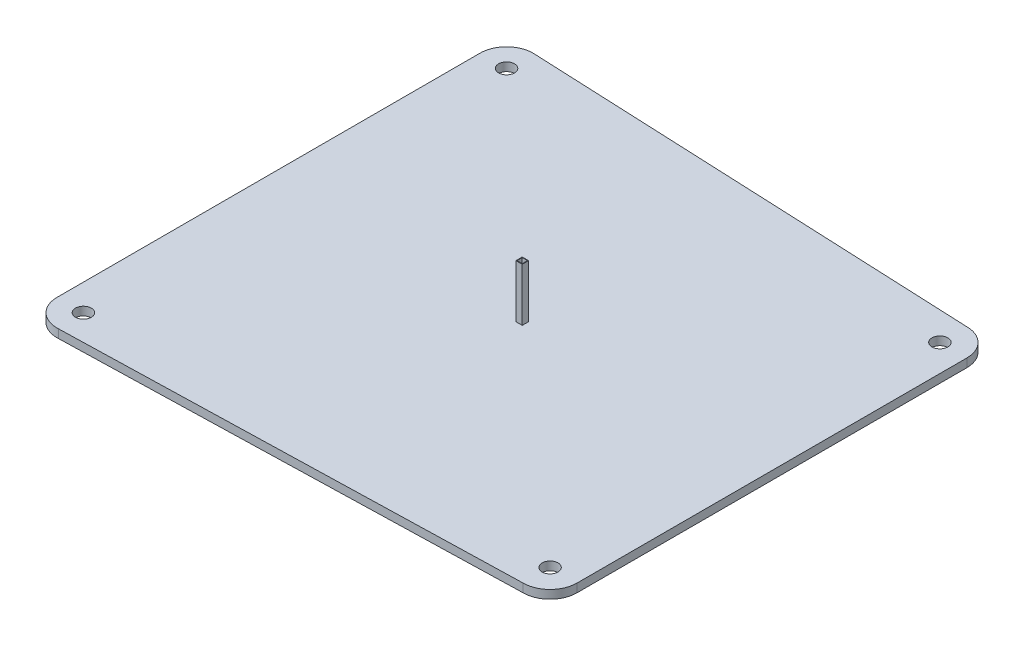
from build123d import *

# Parameters (mm, degrees)
SKETCH1_W              = 95.89
SKETCH1_H              = 90.17
SUBSTRATE_DEPTH        = 1.6
SKETCH2_R              = 1.5
CUT_EXTRUDE2_DEPTH     = 10
SKETCH3_W              = 1.2
SKETCH3_H              = 1.2
SKETCH3_W_2            = 1
SKETCH3_H_2            = 1
CENTRE_ALIGNMENT_DEPTH = 10
SKETCH4_OUTSIDE_W      = 124.318
SKETCH4_OUTSIDE_H      = 118.598
CUT_EXTRUDE3_DEPTH     = 10


with BuildPart() as part:
    # Sketch1 → Substrate (new body)
    with BuildSketch(Plane(origin=(0, 0, 0), x_dir=(1, 0, 0), z_dir=(0, 1, 0))):
        Rectangle(SKETCH1_W, SKETCH1_H)
    extrude(amount=SUBSTRATE_DEPTH)

    # Sketch2 → Cut-Extrude2 (cut)
    with BuildSketch(Plane(origin=(0, 1.6, 0), x_dir=(1, 0, 0), z_dir=(0, 1, 0))):
        with Locations(Location((42.845, 36.085, 0), (0, 0, 270))):
            Circle(SKETCH2_R)
        with Locations(Location((42.845, -37.585, 0), (0, 0, 270))):
            Circle(SKETCH2_R)
        with Locations(Location((-42.945, -39.985, 0), (0, 0, 270))):
            Circle(SKETCH2_R)
        with Locations(Location((-42.945, 39.985, 0), (0, 0, 270))):
            Circle(SKETCH2_R)
    extrude(amount=-CUT_EXTRUDE2_DEPTH, mode=Mode.SUBTRACT)

    # Sketch3 → Centre Alignment (add)
    with BuildSketch(Plane(origin=(0, 1.6, 0), x_dir=(1, 0, 0), z_dir=(0, 1, 0))):
        Rectangle(SKETCH3_W, SKETCH3_H)
        Rectangle(SKETCH3_W_2, SKETCH3_H_2, mode=Mode.SUBTRACT)
    extrude(amount=CENTRE_ALIGNMENT_DEPTH)

    # Sketch4 outside → Cut-Extrude3 (cut)
    with BuildSketch(Plane(origin=(0, 1.6, 0), x_dir=(1, 0, 0), z_dir=(0, 1, 0))):
        Rectangle(SKETCH4_OUTSIDE_W, SKETCH4_OUTSIDE_H)
        with BuildLine():
            Line((-42.677096043, -44.977817588), (42.845, -42.685))
            ThreePointArc((42.845, -42.685), (46.451244584, -41.191244584), (47.945, -37.585))
            Line((47.945, -37.585), (47.945, 36.085))
            ThreePointArc((47.945, 36.085), (46.451244584, 39.691244584), (42.845, 41.185))
            Line((42.845, 41.185), (-42.502925272, 44.965418651))
            ThreePointArc((-42.502925272, 44.965418651), (-46.320620414, 43.673520953), (-47.945, 39.985))
            Line((-47.945, 39.985), (-47.945, -39.985))
            ThreePointArc((-47.945, -39.985), (-46.384511609, -43.614016381), (-42.677096043, -44.977817588))
        make_face(mode=Mode.SUBTRACT)
    extrude(amount=-CUT_EXTRUDE3_DEPTH, mode=Mode.SUBTRACT)


solid = part.part
